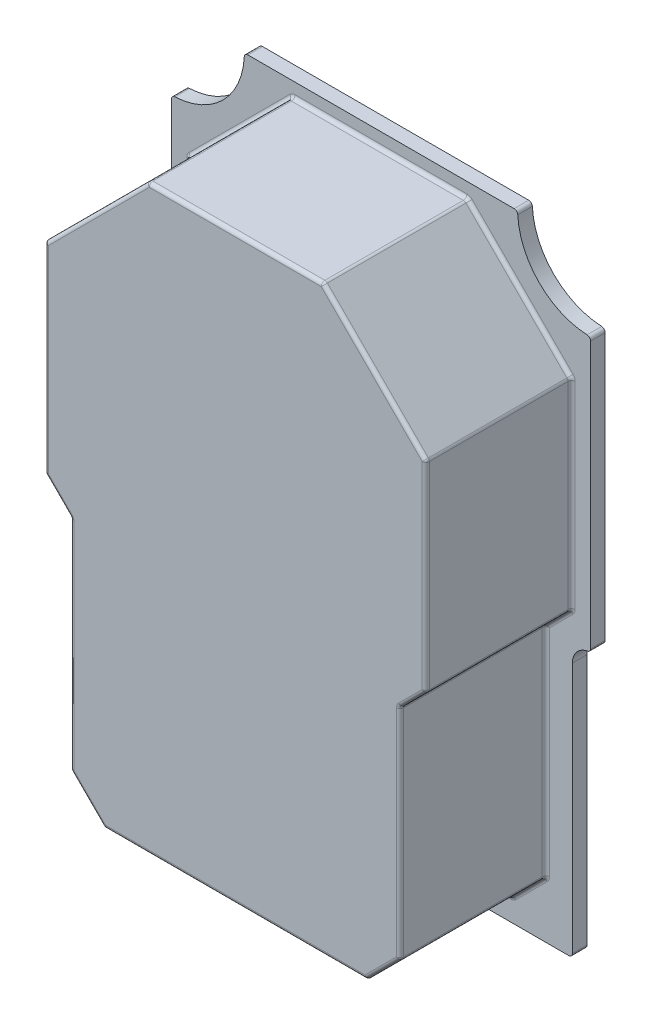
from build123d import *

# Parameters (mm, degrees)
Y_KSEKLIK_EKSTR_ZYON5_DEPTH = 4
Y_KSEKLIK_EKSTR_ZYON6_DEPTH = 40
RADYUS2_R                   = 1
KES_EKSTR_ZYON1_DEPTH       = 4
KES_EKSTR_ZYON2_DEPTH       = 35


with BuildPart() as part:
    # Çizim1 → Yükseklik-Ekstrüzyon5 (new body)
    with BuildSketch(Plane.XY):
        with BuildLine():
            Line((20, 0), (95, 0))
            ThreePointArc((95, 0), (100.857864376, -14.142135624), (115, -20))
            Line((115, -20), (115, -95))
            ThreePointArc((115, -95), (111.464466094, -96.464466094), (110, -100))
            Line((110, -100), (110, -170))
            Line((110, -170), (5, -170))
            Line((5, -170), (5, -100))
            ThreePointArc((5, -100), (3.535533906, -96.464466094), (0, -95))
            Line((0, -95), (0, -20))
            ThreePointArc((0, -20), (14.142135624, -14.142135624), (20, 0))
        make_face()
    extrude(amount=Y_KSEKLIK_EKSTR_ZYON5_DEPTH)

    # Çizim6 → Yükseklik-Ekstrüzyon6 (add)
    with BuildSketch(Plane.XY.offset(4)):
        Polygon((33.5, -4), (81.5, -4), (109.784271247, -32.284271247), (109.784271247, -87.284271247), (102.713203436, -94.355339059), (102.713203436, -154.355339059), (93.52081528, -163.547727215), (21.47918472, -163.547727215), (12.286796564, -154.355339059), (12.286796564, -94.355339059), (5.215728753, -87.284271247), (5.215728753, -32.284271247), align=None)
    extrude(amount=Y_KSEKLIK_EKSTR_ZYON6_DEPTH)

    # Radyus2
    radyus2_edges = [part.edges().sort_by_distance(p)[0] for p in [
        (20, 0, 2),
        (95, 0, 2),
        (115, -20, 2),
        (115, -95, 2),
        (110, -170, 2),
        (5, -170, 2),
        (0, -95, 2),
        (0, -20, 2),
        (95.642135624, -18.142135624, 4),
        (109.784271247, -32.284271247, 24),
        (57.5, -4, 4),
        (81.5, -4, 24),
        (19.357864376, -18.142135624, 4),
        (33.5, -4, 24),
        (5.215728753, -59.784271247, 4),
        (5.215728753, -32.284271247, 24),
        (8.751262658, -90.819805153, 4),
        (5.215728753, -87.284271247, 24),
        (12.286796564, -124.355339059, 4),
        (12.286796564, -94.355339059, 24),
        (16.882990642, -158.951533137, 4),
        (12.286796564, -154.355339059, 24),
        (57.5, -163.547727215, 4),
        (21.47918472, -163.547727215, 24),
        (98.117009358, -158.951533137, 4),
        (93.52081528, -163.547727215, 24),
        (102.713203436, -124.355339059, 4),
        (102.713203436, -154.355339059, 24),
        (106.248737342, -90.819805153, 4),
        (102.713203436, -94.355339059, 24),
        (109.784271247, -59.784271247, 4),
        (109.784271247, -87.284271247, 24),
        (95.642135624, -18.142135624, 44),
        (57.5, -4, 44),
        (19.357864376, -18.142135624, 44),
        (5.215728753, -59.784271247, 44),
        (8.751262658, -90.819805153, 44),
        (12.286796564, -124.355339059, 44),
        (16.882990642, -158.951533137, 44),
        (57.5, -163.547727215, 44),
        (98.117009358, -158.951533137, 44),
        (102.713203436, -124.355339059, 44),
        (106.248737342, -90.819805153, 44),
        (109.784271247, -59.784271247, 44),
    ]]
    fillet(radyus2_edges, radius=RADYUS2_R)

    # Çizim8 → Kes-Ekstrüzyon1 (cut)
    with BuildSketch(Plane(origin=(0, 0, 0), x_dir=(-1, 0, 0), z_dir=(0, 0, -1))):
        Polygon((-81.5, -5), (-33.5, -5), (-5.215728753, -33.284271247), (-5.215728753, -88.284271247), (-12.286796564, -95.355339059), (-12.286796564, -153.355339059), (-21.47918472, -162.547727215), (-93.52081528, -162.547727215), (-102.713203436, -153.355339059), (-102.713203436, -95.355339059), (-109.784271247, -88.284271247), (-109.784271247, -33.284271247), align=None)
    extrude(amount=-KES_EKSTR_ZYON1_DEPTH, mode=Mode.SUBTRACT)

    # Çizim9 → Kes-Ekstrüzyon2 (cut)
    with BuildSketch(Plane(origin=(0, 0, 4), x_dir=(-1, 0, 0), z_dir=(0, 0, -1))):
        Polygon((-80.5, -7), (-34.5, -7), (-6.922835534, -34.577164466), (-6.922835534, -86.577164466), (-14.701010127, -94.355339059), (-14.701010127, -150.355339059), (-22.47918472, -158.133513652), (-92.52081528, -158.133513652), (-100.298989873, -150.355339059), (-100.298989873, -94.355339059), (-108.077164466, -86.577164466), (-108.077164466, -34.577164466), align=None)
    extrude(amount=-KES_EKSTR_ZYON2_DEPTH, mode=Mode.SUBTRACT)


solid = part.part
